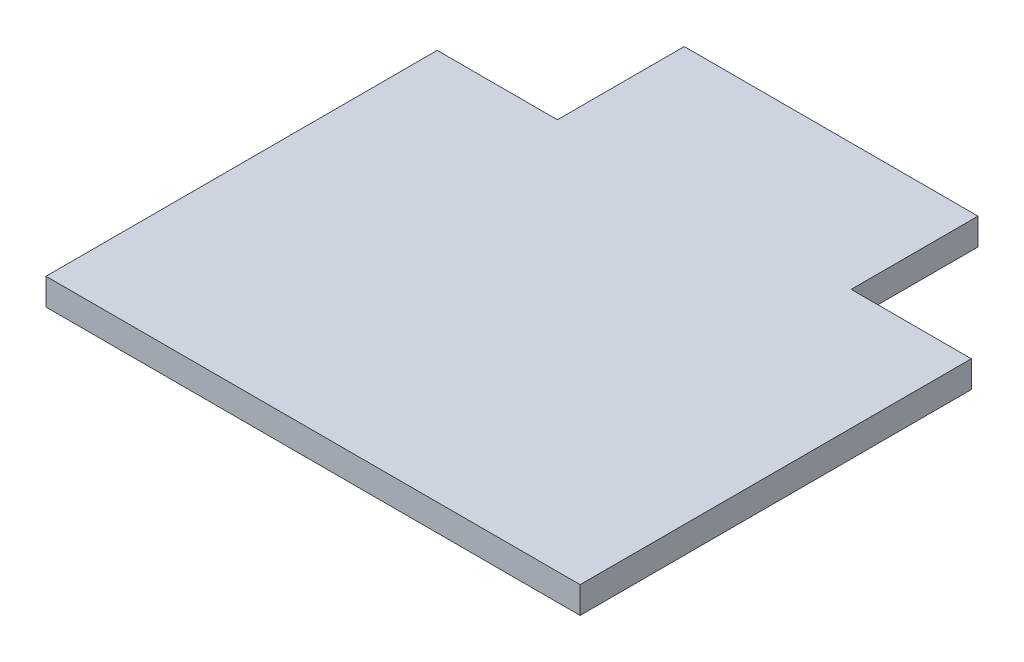
from build123d import *

# Parameters (mm, degrees)
EXTRUDE_1_DEPTH = 2


with BuildPart() as part:
    # 草图1 → 凸台-拉伸1 (new body)
    with BuildSketch(Plane(origin=(0, 0, 0), x_dir=(1, 0, 0), z_dir=(0, 1, 0))):
        Polygon((0, 0), (0, -29.3), (40, -29.3), (40, 0), (31, 0), (31, 9.5), (9, 9.5), (9, 0), align=None)
    extrude(amount=EXTRUDE_1_DEPTH)


solid = part.part
